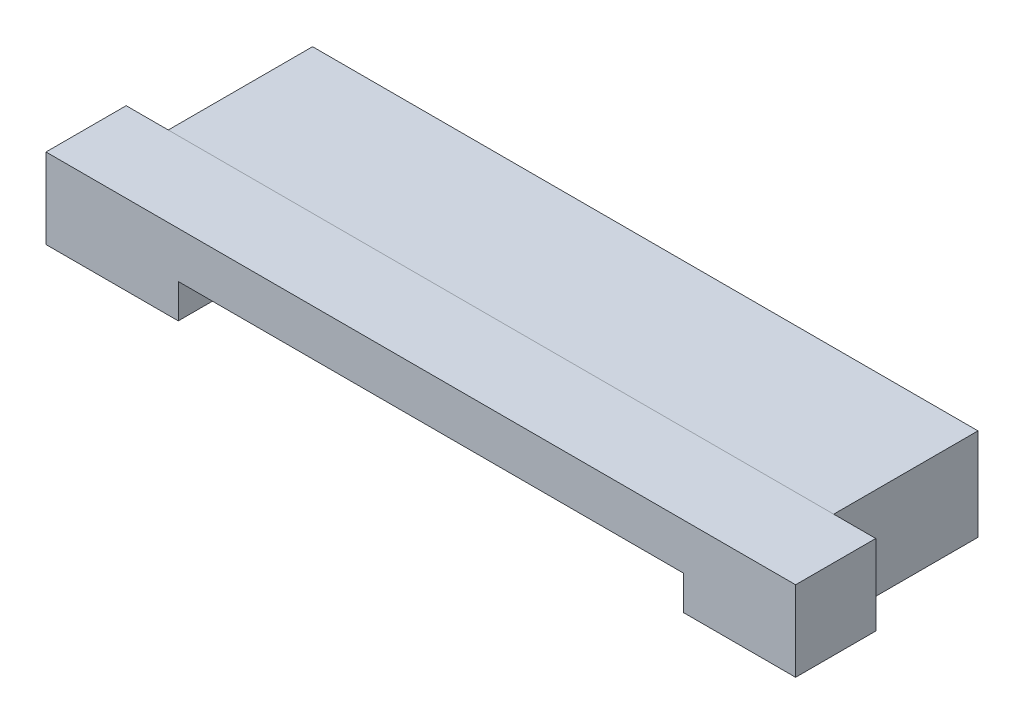
from build123d import *

# Parameters (mm, degrees)
SKETCH1_W           = 16.6
SKETCH1_H           = 3.6
BOSS_EXTRUDE1_DEPTH = 2.3
SKETCH2_W           = 18.7
SKETCH2_H           = 2
BOSS_EXTRUDE2_DEPTH = 2
BOSS_EXTRUDE5_DEPTH = 0.1
LPATTERN2_COUNT     = 24
LPATTERN2_PITCH     = 0.5
SKETCH4_W           = 12.6
SKETCH4_H           = 0.85237051
CUT_EXTRUDE2_DEPTH  = 2


with BuildPart() as part:
    # Sketch1 → Boss-Extrude1 (new body)
    with BuildSketch(Plane(origin=(0, 0, 0), x_dir=(1, 0, 0), z_dir=(0, 1, 0))):
        with Locations((8.3, 1.8)):
            Rectangle(SKETCH1_W, SKETCH1_H)
    extrude(amount=BOSS_EXTRUDE1_DEPTH)

    # Sketch3 → Boss-Extrude5 (add, symmetric)
    with BuildSketch(Plane.ZY.offset(-2.55)):
        Polygon((-3.6, 0), (-4.6, 0), (-4.6, 0.3), (-3.9, 0.3), (-3.9, 0.7), (-3.6, 0.7), align=None)
    boss_extrude5 = extrude(amount=BOSS_EXTRUDE5_DEPTH, both=True)

    # LPattern2: Boss-Extrude5 ×24
    with Locations(*[(i * LPATTERN2_PITCH, 0, 0) for i in range(1, LPATTERN2_COUNT)]):
        add(boss_extrude5)


with BuildPart() as body_2:
    # Sketch2 → Boss-Extrude2 (new body)
    with BuildSketch(Plane(origin=(0, 2.3, 0), x_dir=(1, 0, 0), z_dir=(0, 1, 0))):
        with Locations((8.3, -1)):
            Rectangle(SKETCH2_W, SKETCH2_H)
    extrude(amount=-BOSS_EXTRUDE2_DEPTH)

    # Sketch4 → Cut-Extrude2 (cut)
    with BuildSketch(Plane.XY.offset(2)):
        with Locations((8.55, 0.726185255)):
            Rectangle(SKETCH4_W, SKETCH4_H)
    extrude(amount=-CUT_EXTRUDE2_DEPTH, mode=Mode.SUBTRACT)


solid = Compound([part.part, body_2.part])
